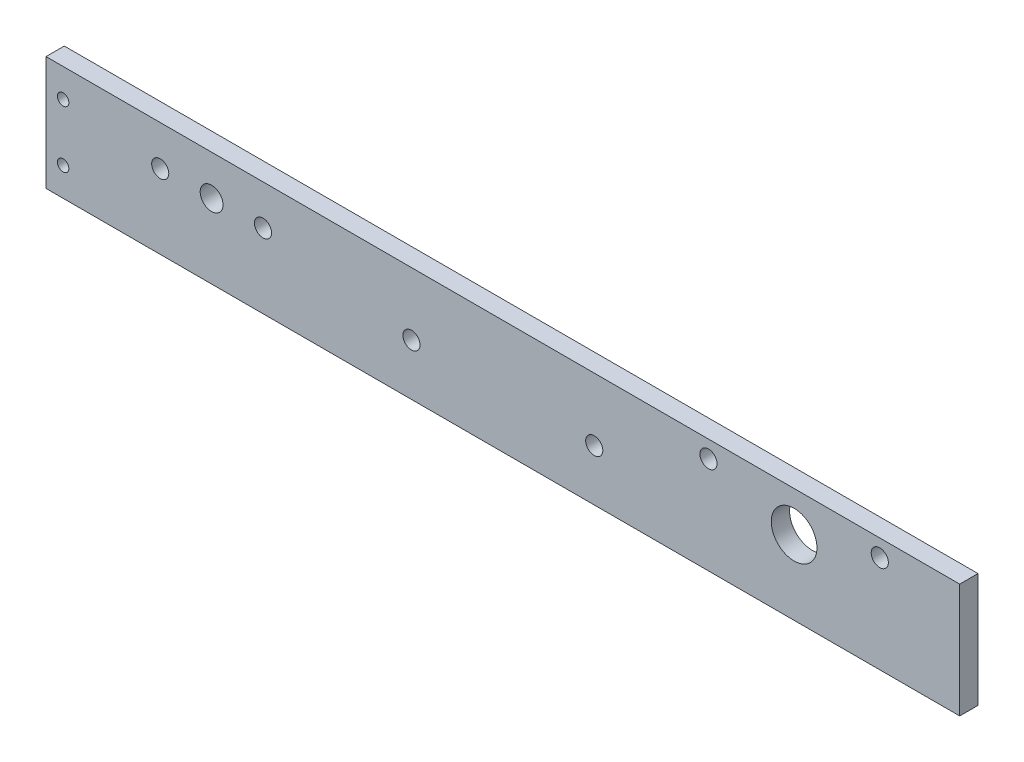
from build123d import *

# Parameters (mm, degrees)
SKETCH2_W               = 160
SKETCH2_H               = 20
BOSS_EXTRUDE1_DEPTH     = 3.2
CUT_EXTRUDE1_DEPTH      = 162.276904732
CUT_EXTRUDE1_DEPTH_BACK = 162.276904732
SKETCH5_R               = 4
SKETCH5_R_2             = 2
SKETCH6_R               = 1.5
CUT_EXTRUDE2_DEPTH      = 10
CUT_EXTRUDE3_DEPTH      = 162.276904732
CUT_EXTRUDE3_DEPTH_BACK = 162.276904732
SKETCH7_R               = 1
SKETCH8_R               = 1.5
CUT_EXTRUDE4_DEPTH      = 10
SKETCH9_R               = 1.5
CUT_EXTRUDE5_DEPTH      = 10


with BuildPart() as part:
    # Sketch2 → Boss-Extrude1 (new body)
    with BuildSketch(Plane(origin=(0, -10, 10), x_dir=(1, 0, 0), z_dir=(0, 0, -1))):
        with Locations((80, 0)):
            Rectangle(SKETCH2_W, SKETCH2_H)
    extrude(amount=BOSS_EXTRUDE1_DEPTH)

    # Sketch5 → Cut-Extrude1 (cut, two sides: drawn at the far end of the back side and taken through both)
    with BuildSketch(Plane.XY.offset(10).offset(-CUT_EXTRUDE1_DEPTH_BACK)):
        with Locations((131, -7)):
            Circle(SKETCH5_R)
        with Locations((29, -7)):
            Circle(SKETCH5_R_2)
    extrude(amount=CUT_EXTRUDE1_DEPTH + CUT_EXTRUDE1_DEPTH_BACK, mode=Mode.SUBTRACT)

    # Sketch6 → Cut-Extrude2 (cut)
    with BuildSketch(Plane.XY.offset(10)):
        with Locations((96, -11)):
            Circle(SKETCH6_R)
        with Locations((64, -11)):
            Circle(SKETCH6_R)
    extrude(amount=-CUT_EXTRUDE2_DEPTH, mode=Mode.SUBTRACT)

    # Sketch7 → Cut-Extrude3 (cut, two sides: drawn at the far end of the back side and taken through both)
    with BuildSketch(Plane.XY.offset(10).offset(-CUT_EXTRUDE3_DEPTH_BACK)):
        with Locations((3, -15)):
            Circle(SKETCH7_R)
        with Locations((3, -5)):
            Circle(SKETCH7_R)
    extrude(amount=CUT_EXTRUDE3_DEPTH + CUT_EXTRUDE3_DEPTH_BACK, mode=Mode.SUBTRACT)

    # Sketch8 → Cut-Extrude4 (cut)
    with BuildSketch(Plane(origin=(0, 0, 6.8), x_dir=(-1, 0, 0), z_dir=(0, 0, -1))):
        with Locations((-116, -3)):
            Circle(SKETCH8_R)
        with Locations((-146, -3)):
            Circle(SKETCH8_R)
    extrude(amount=-CUT_EXTRUDE4_DEPTH, mode=Mode.SUBTRACT)

    # Sketch9 → Cut-Extrude5 (cut)
    with BuildSketch(Plane.XY.offset(10)):
        with Locations((38, -7)):
            Circle(SKETCH9_R)
        with Locations((20, -7)):
            Circle(SKETCH9_R)
    extrude(amount=-CUT_EXTRUDE5_DEPTH, mode=Mode.SUBTRACT)


solid = part.part
